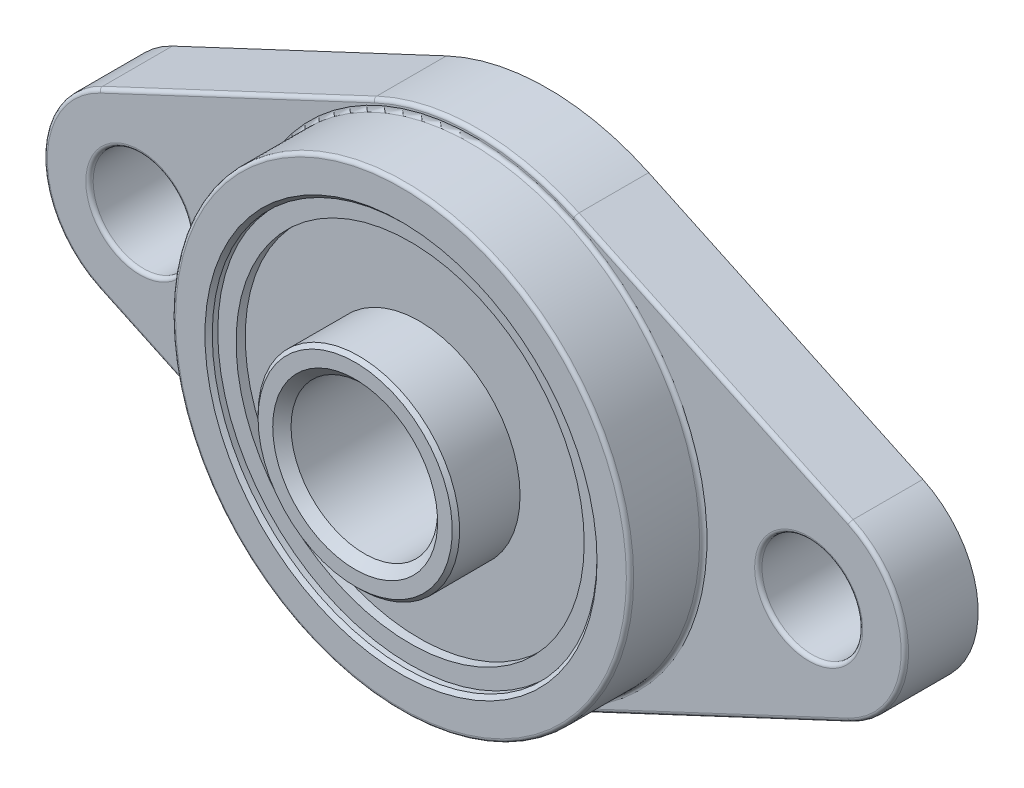
from build123d import *

# Parameters (mm, degrees)
SKETCH1_R               = 10.5
BOSS_EXTRUDE1_DEPTH     = 7
SKETCH2_R               = 9.5
SKETCH2_R_2             = 5.5
CUT_EXTRUDE1_DEPTH      = 0.5
SKETCH3_R               = 5.5
BOSS_EXTRUDE2_DEPTH     = 10
CUT_EXTRUDE2_REACH      = 19.903
SKETCH4_R               = 4
CUT_EXTRUDE3_START      = -0.5
SKETCH5_R               = 9.5
SKETCH5_R_2             = 5.5
CUT_EXTRUDE3_DEPTH      = 0.5
CHAMFER1_SIZE           = 0.5
CHAMFER2_SIZE           = 0.2
BOSS_EXTRUDE3_START     = 1
SKETCH6_R               = 2.75
SKETCH6_R_2             = 10.5
BOSS_EXTRUDE3_DEPTH     = 4
CUT_EXTRUDE4_DEPTH      = 29.835741711
CUT_EXTRUDE4_DEPTH_BACK = 0.4
SKETCH7_R               = 10.5
FILLET1_R               = 1
SKETCH8_R               = 12.5
SKETCH8_R_2             = 10.5
BOSS_EXTRUDE4_DEPTH     = 4
FILLET2_R               = 0.2
FILLET3_R               = 0.2
CHAMFER3_SIZE           = 0.2


with BuildPart() as part:
    # Sketch1 → Boss-Extrude1 (new body)
    with BuildSketch(Plane.XY):
        Circle(SKETCH1_R)
    extrude(amount=BOSS_EXTRUDE1_DEPTH)

    # Sketch2 → Cut-Extrude1 (cut)
    with BuildSketch(Plane(origin=(0, 0, 0), x_dir=(-1, 0, 0), z_dir=(0, 0, -1))):
        Circle(SKETCH2_R)
        Circle(SKETCH2_R_2, mode=Mode.SUBTRACT)
    extrude(amount=-CUT_EXTRUDE1_DEPTH, mode=Mode.SUBTRACT)

    # Sketch3 → Boss-Extrude2 (add)
    with BuildSketch(Plane(origin=(0, 0, 0), x_dir=(-1, 0, 0), z_dir=(0, 0, -1))):
        Circle(SKETCH3_R)
    extrude(amount=-BOSS_EXTRUDE2_DEPTH)

    # Sketch4 → Cut-Extrude2 (cut, up to next)
    with BuildSketch(Plane(origin=(0, 0, 0), x_dir=(-1, 0, 0), z_dir=(0, 0, -1)), mode=Mode.PRIVATE) as cut_extrude2_sk1:
        Circle(SKETCH4_R)
    cut_extrude2_tool1 = extrude(cut_extrude2_sk1.sketch, amount=-CUT_EXTRUDE2_REACH, mode=Mode.PRIVATE) & part.part
    add(cut_extrude2_tool1.solids().sort_by_distance((0, 0, 0))[0], mode=Mode.SUBTRACT)

    # Sketch5 → Cut-Extrude3 (cut)
    with BuildSketch(Plane.XY.offset(7).offset(CUT_EXTRUDE3_START)):
        with Locations(Location((0, 0, 0), (0, 0, 180))):
            Circle(SKETCH5_R)
        with Locations(Location((0, 0, 0), (0, 0, 180))):
            Circle(SKETCH5_R_2, mode=Mode.SUBTRACT)
    extrude(amount=CUT_EXTRUDE3_DEPTH, mode=Mode.SUBTRACT)

    # Chamfer1
    chamfer1_edges = [part.edges().sort_by_distance(p)[0] for p in [
        (4, 0, 0),
        (4, 0, 10),
    ]]
    chamfer(chamfer1_edges, length=CHAMFER1_SIZE)

    # Chamfer2
    chamfer2_edges = [part.edges().sort_by_distance(p)[0] for p in [
        (5.5, 0, 10),
        (5.5, 0, 0),
    ]]
    chamfer(chamfer2_edges, length=CHAMFER2_SIZE)

    # Sketch6 → Boss-Extrude3 (add)
    with BuildSketch(Plane(origin=(0, 0, 0.5), x_dir=(-1, 0, 0), z_dir=(0, 0, -1)).offset(BOSS_EXTRUDE3_START)):
        with BuildLine():
            Line((-5.520547945, 11.769602813), (-20.479452055, 4.753108828))
            ThreePointArc((-20.479452055, 4.753108828), (-23.5, 0), (-20.479452055, -4.753108828))
            Line((-20.479452055, -4.753108828), (-5.520547945, -11.769602813))
            ThreePointArc((-5.520547945, -11.769602813), (0, -13), (5.520547945, -11.769602813))
            Line((5.520547945, -11.769602813), (20.479452055, -4.753108828))
            ThreePointArc((20.479452055, -4.753108828), (23.5, 0), (20.479452055, 4.753108828))
            Line((20.479452055, 4.753108828), (5.520547945, 11.769602813))
            ThreePointArc((5.520547945, 11.769602813), (0, 13), (-5.520547945, 11.769602813))
        make_face()
        with Locations((-18.25, 0)):
            Circle(SKETCH6_R, mode=Mode.SUBTRACT)
        Circle(SKETCH6_R_2, mode=Mode.SUBTRACT)
        with Locations((18.25, 0)):
            Circle(SKETCH6_R, mode=Mode.SUBTRACT)
    extrude(amount=-BOSS_EXTRUDE3_DEPTH)

    # Sketch7 → Cut-Extrude4 (cut, two sides: drawn at the far end of the back side and taken through both)
    with BuildSketch(Plane(origin=(0, 0, -0.5), x_dir=(-1, 0, 0), z_dir=(0, 0, -1)).offset(-CUT_EXTRUDE4_DEPTH_BACK)):
        with BuildLine():
            Line((-5.295863726, 10.208027596), (-17.090834482, 4.08886724))
            ThreePointArc((-17.090834482, 4.08886724), (-14, 0), (-17.090834482, -4.08886724))
            Line((-17.090834482, -4.08886724), (-5.295863726, -10.208027596))
            ThreePointArc((-5.295863726, -10.208027596), (0, -11.5), (5.295863726, -10.208027596))
            Line((5.295863726, -10.208027596), (5.334826246, -10.187814073))
            Line((5.334826246, -10.187814073), (17.090834482, -4.08886724))
            ThreePointArc((17.090834482, -4.08886724), (14, 0), (17.090834482, 4.08886724))
            Line((17.090834482, 4.08886724), (5.334826246, 10.187814073))
            Line((5.334826246, 10.187814073), (5.295863726, 10.208027596))
            ThreePointArc((5.295863726, 10.208027596), (0, 11.5), (-5.295863726, 10.208027596))
        make_face()
        Circle(SKETCH7_R, mode=Mode.SUBTRACT)
    extrude(amount=CUT_EXTRUDE4_DEPTH + CUT_EXTRUDE4_DEPTH_BACK, mode=Mode.SUBTRACT)

    # Fillet1
    fillet1_edges = [part.edges().sort_by_distance(p)[0] for p in [
        (-17.090834482, 4.08886724, -0.3),
        (-17.090834482, -4.08886724, -0.3),
        (17.090834482, -4.08886724, -0.3),
        (17.090834482, 4.08886724, -0.3),
    ]]
    fillet(fillet1_edges, radius=FILLET1_R)

    # Sketch8 → Boss-Extrude4 (add)
    with BuildSketch(Plane.XY.offset(3.5)):
        with Locations(Location((0, 0, 0), (0, 0, 180))):
            Circle(SKETCH8_R)
        with Locations(Location((0, 0, 0), (0, 0, 180))):
            Circle(SKETCH8_R_2, mode=Mode.SUBTRACT)
    extrude(amount=BOSS_EXTRUDE4_DEPTH)

    # Fillet2
    fillet2_edges = [part.edges().sort_by_distance(p)[0] for p in [
        (12.5, 0, 7.5),
    ]]
    fillet(fillet2_edges, radius=FILLET2_R)

    # Fillet3
    fillet3_edges = [part.edges().sort_by_distance(p)[0] for p in [
        (12.5, 0, 3.5),
        (13, -8.261355821, 3.5),
        (23.5, 0, 3.5),
        (-13, 8.261355821, 3.5),
        (-15.5, 0, 3.5),
        (0, -13, 3.5),
        (21, 0, 3.5),
        (13, 8.261355821, 3.5),
        (0, 13, 3.5),
        (-23.5, 0, 3.5),
        (-13, -8.261355821, 3.5),
    ]]
    fillet(fillet3_edges, radius=FILLET3_R)

    # Chamfer3
    chamfer3_edges = [part.edges().sort_by_distance(p)[0] for p in [
        (10.5, 0, 7.5),
    ]]
    chamfer(chamfer3_edges, length=CHAMFER3_SIZE)


solid = part.part
